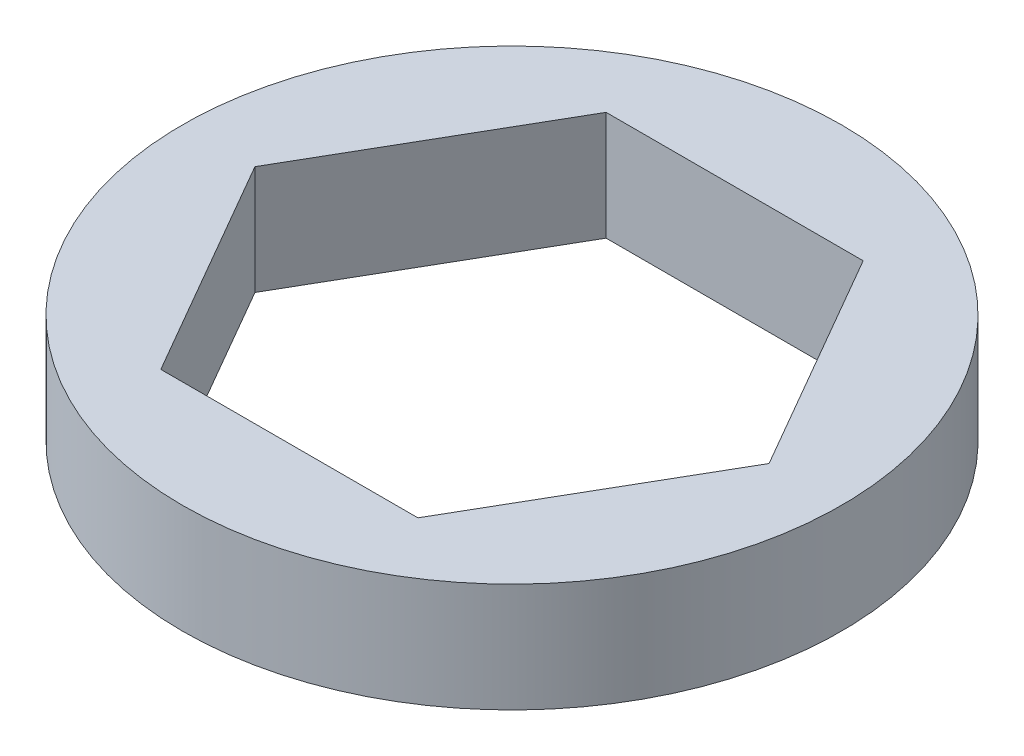
from build123d import *

# Parameters (mm, degrees)
SKETCH1_R           = 7.14375
BOSS_EXTRUDE1_DEPTH = 1.1811


with BuildPart() as part:
    # Sketch1 → Boss-Extrude1 (new, symmetric)
    with BuildSketch(Plane(origin=(0, 0, 0), x_dir=(1, 0, 0), z_dir=(0, 1, 0))):
        with Locations(Location((0, 0, 0), (0, 0, 270))):
            Circle(SKETCH1_R)
        Polygon((2.786292399, -4.826), (5.572584798, 0), (2.786292399, 4.826), (-2.786292399, 4.826), (-5.572584798, 0), (-2.786292399, -4.826), align=None, mode=Mode.SUBTRACT)
    extrude(amount=BOSS_EXTRUDE1_DEPTH, both=True)


solid = part.part
